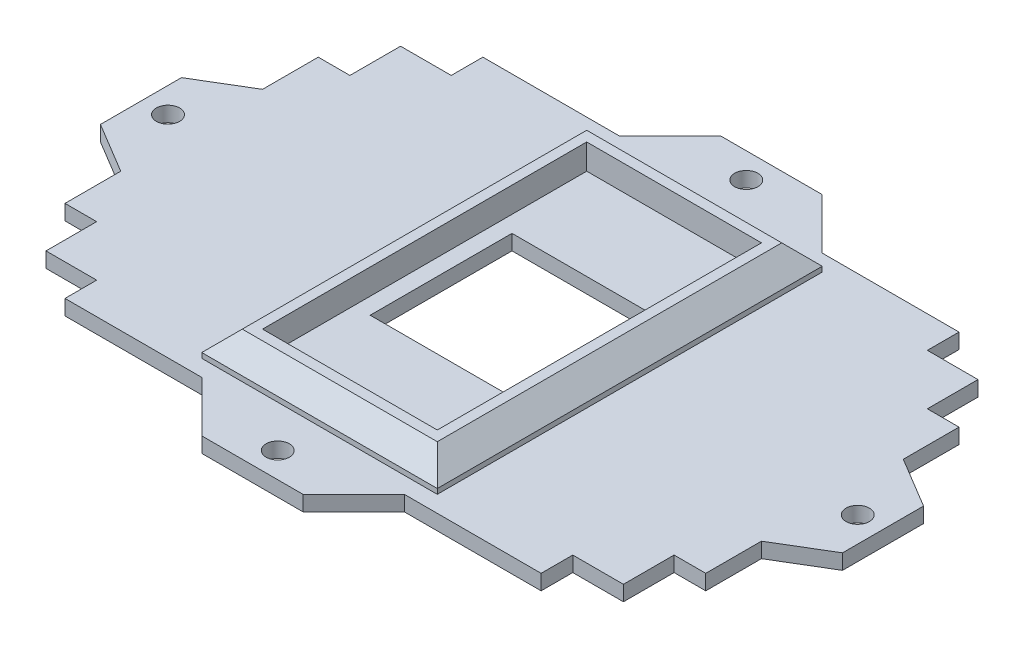
from build123d import *

# Parameters (mm, degrees)
SKETCH_1_R      = 2.3
SKETCH_1_W      = 28
SKETCH_1_H      = 28
EXTRUDE_1_DEPTH = 3
SKETCH_2_W      = 46.5
SKETCH_2_H      = 76
SKETCH_2_W_2    = 34.5
SKETCH_2_H_2    = 64
EXTRUDE_2_DEPTH = 5
CHAMFER_1_SIZE  = 4


with BuildPart() as part:
    # Эскиз1 → Бобышка-Вытянуть1 (new body)
    with BuildSketch(Plane(origin=(0, 89.195974268, 0), x_dir=(1, 0, 0), z_dir=(0, 1, 0))):
        Polygon((44.808980694, -48.273129836), (54.808980694, -38.273129836), (74.808980694, -38.273129836), (84.808980694, -48.273129836), (111.808980694, -48.273129836), (111.808980694, -54.523129836), (121.808980694, -54.523129836), (121.808980694, -64.523129836), (128.058980694, -64.523129836), (128.058980694, -75.523129836), (138.058980694, -81.523129836), (138.058980694, -97.523129836), (128.058980694, -103.523129836), (128.058980694, -114.523129836), (121.808980694, -114.523129836), (121.808980694, -124.523129836), (111.808980694, -124.523129836), (111.808980694, -130.773129836), (84.808980694, -130.773129836), (74.808980694, -140.773129836), (54.808980694, -140.773129836), (44.808980694, -130.773129836), (17.808980694, -130.773129836), (17.808980694, -124.523129836), (7.808980694, -124.523129836), (7.808980694, -114.523129836), (1.558980694, -114.523129836), (1.558980694, -103.523129836), (-8.441019306, -97.523129836), (-8.441019306, -81.523129836), (1.558980694, -75.523129836), (1.558980694, -64.523129836), (7.808980694, -64.523129836), (7.808980694, -54.523129836), (17.808980694, -54.523129836), (17.808980694, -48.273129836), align=None)
        with Locations(Location((-3.441019306, -89.187817333, 0), (0, 0, 180))):
            Circle(SKETCH_1_R, mode=Mode.SUBTRACT)
        with Locations(Location((64.808980694, -43.273129836, 0), (0, 0, 180))):
            Circle(SKETCH_1_R, mode=Mode.SUBTRACT)
        with Locations(Location((133.058980694, -89.523129836, 0), (0, 0, 180))):
            Circle(SKETCH_1_R, mode=Mode.SUBTRACT)
        with Locations(Location((64.808980694, -135.773129836, 0), (0, 0, 180))):
            Circle(SKETCH_1_R, mode=Mode.SUBTRACT)
        with Locations((64.808980694, -89.523129836)):
            Rectangle(SKETCH_1_W, SKETCH_1_H, mode=Mode.SUBTRACT)
    extrude(amount=EXTRUDE_1_DEPTH)

    # Эскиз2 → Бобышка-Вытянуть2 (add)
    with BuildSketch(Plane(origin=(0, 92.195974268, 0), x_dir=(1, 0, 0), z_dir=(0, 1, 0))):
        with Locations((64.808980694, -89.523129836)):
            Rectangle(SKETCH_2_W, SKETCH_2_H)
        with Locations((64.808980694, -89.523129836)):
            Rectangle(SKETCH_2_W_2, SKETCH_2_H_2, mode=Mode.SUBTRACT)
    extrude(amount=EXTRUDE_2_DEPTH)

    # Фаска1
    chamfer_1_edges = [part.edges().sort_by_distance(p)[0] for p in [
        (41.558980694, 97.195974268, 89.523129836),
        (64.808980694, 97.195974268, 127.523129836),
        (88.058980694, 97.195974268, 89.523129836),
        (64.808980694, 97.195974268, 51.523129836),
    ]]
    chamfer(chamfer_1_edges, length=CHAMFER_1_SIZE)


solid = part.part
